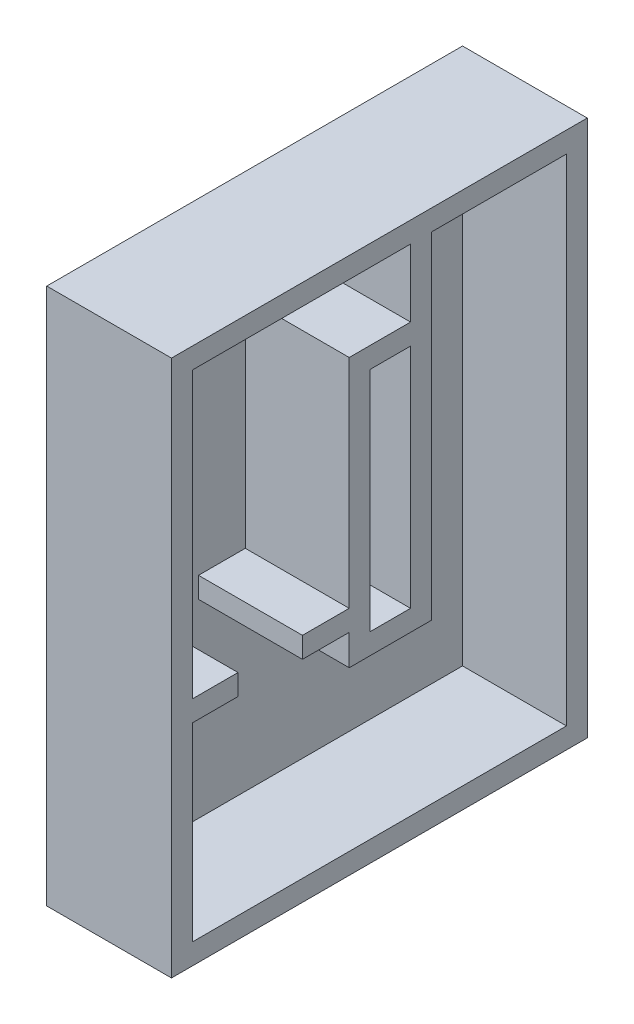
from build123d import *

# Parameters (mm, degrees)
SKETCH_1_W      = 40
SKETCH_1_H      = 51.65
EXTRUDE_1_DEPTH = 12
SHELL_1_T       = -2
SKETCH_3_W      = 3.9
SKETCH_3_H      = 21.85
SKETCH_3_W_2    = 4.4
SKETCH_3_H_2    = 2
EXTRUDE_6_DEPTH = 10


with BuildPart() as part:
    # 草图1 → 凸台-拉伸1 (new body)
    with BuildSketch(Plane(origin=(0, 0, 0), x_dir=(0, 0, -1), z_dir=(1, 0, 0))):
        Rectangle(SKETCH_1_W, SKETCH_1_H)
    extrude(amount=EXTRUDE_1_DEPTH)

    # 抽壳1
    shell_1_openings = [part.faces().sort_by_distance(p)[0] for p in [
        (12, 0, 0),
    ]]
    offset(amount=SHELL_1_T, openings=shell_1_openings, kind=Kind.INTERSECTION)

    # 草图3 → 凸台-拉伸6 (add)
    # profile 1 of 2: a face of its own
    with BuildSketch(Plane(origin=(2, 0, 0), x_dir=(0, 0, -1), z_dir=(1, 0, 0))):
        Polygon((-2.9, 17.325), (3, 17.325), (3, 23.825), (5, 23.825), (5, 17.175), (5, -8.525), (-2.9, -8.525), (-2.9, -5.575), (-7.4, -5.575), (-7.4, -3.575), (-2.9, -3.575), align=None)
        with Locations((1.05, 4.4)):
            Rectangle(SKETCH_3_W, SKETCH_3_H, mode=Mode.SUBTRACT)
    # profile 2 of 2: a face of its own
    with BuildSketch(Plane(origin=(2, 0, 0), x_dir=(0, 0, -1), z_dir=(1, 0, 0))):
        with Locations((-15.8, -4.575)):
            Rectangle(SKETCH_3_W_2, SKETCH_3_H_2)
    extrude(amount=EXTRUDE_6_DEPTH)


solid = part.part
